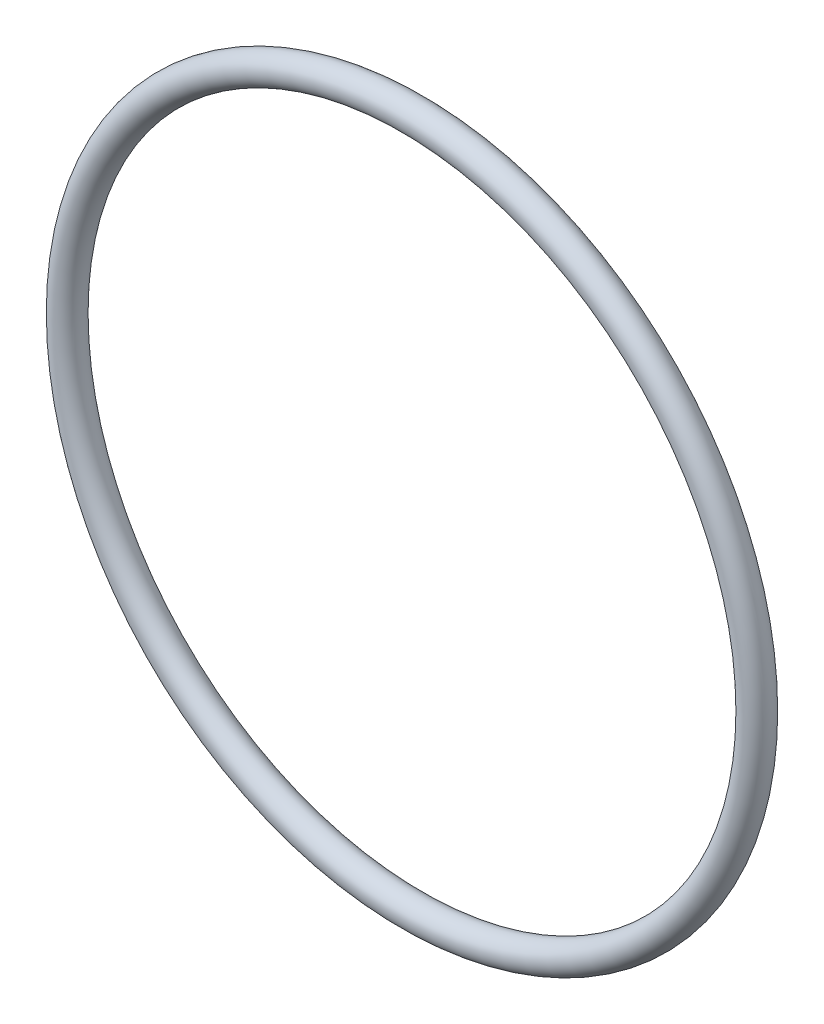
from build123d import *

# Parameters (mm, degrees)
SK_ORING67_R = 1.5


with BuildPart() as part:
    # Sk_oring67 → Rev_oring67 (revolve)
    with BuildSketch(Plane(origin=(0, 0, 0), x_dir=(1, 0, 0), z_dir=(0, 1, 0)), mode=Mode.PRIVATE) as rev_oring67_sk:
        with Locations((35, 0)):
            Circle(SK_ORING67_R)
    revolve(rev_oring67_sk.sketch.rotate(Axis((0, 0, 0), (0, 0, 1)), 180), axis=Axis((0, 0, 0), (0, 0, 1)))


solid = part.part
